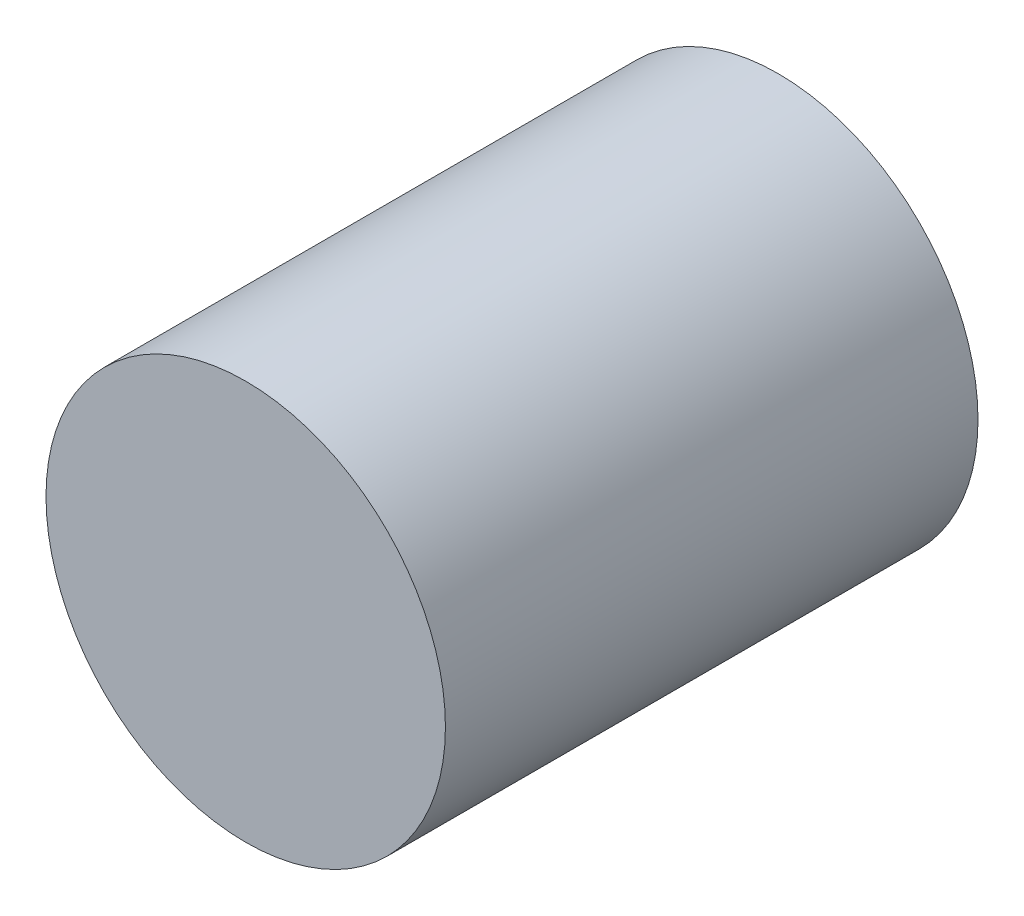
from build123d import *

# Parameters (mm, degrees)
ESQUISSE1_R        = 45
BOSS_EXTRU_1_DEPTH = 60


with BuildPart() as part:
    # Esquisse1 → Boss.-Extru.1 (new, symmetric)
    with BuildSketch(Plane.XY):
        Circle(ESQUISSE1_R)
    extrude(amount=BOSS_EXTRU_1_DEPTH, both=True)


solid = part.part
